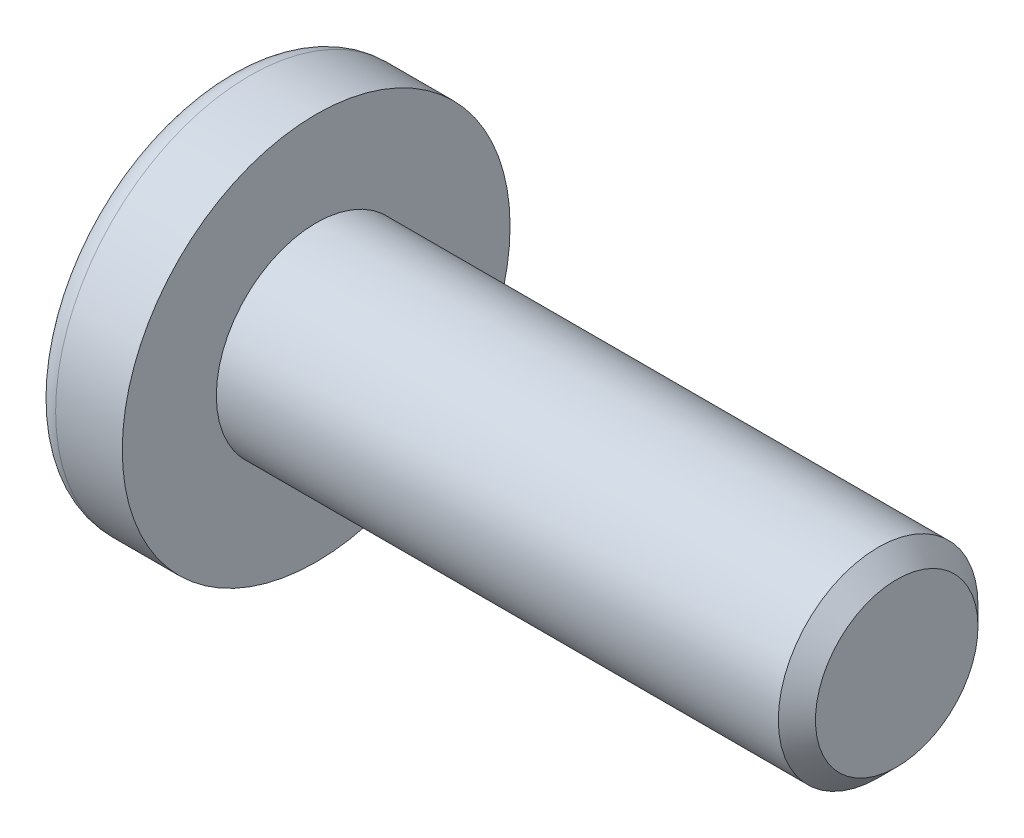
from build123d import *

# Parameters (mm, degrees)
CIRPATTERN1_COUNT = 2
CIRPATTERN1_ANGLE = 90
CHAMFER1_SIZE     = 0.2032


with BuildPart() as part:
    # BodySke → Base-Revolve (revolve)
    with BuildSketch(Plane.XY, mode=Mode.PRIVATE) as base_revolve_sk:
        with BuildLine():
            Line((1.5748, 1.0922), (1.5748, 2.1209))
            Line((1.5748, 2.1209), (0.845695803, 2.1209))
            ThreePointArc((0.845695803, 2.1209), (0.728748015, 2.09237553), (0.638066948, 2.013208777))
            ThreePointArc((0.638066948, 2.013208777), (0.163333253, 1.05595206), (0, 0))
            Line((0, 0), (7.9248, 0))
            Line((7.9248, 0), (7.9248, 1.0922))
            Line((7.9248, 1.0922), (1.5748, 1.0922))
        make_face()
    revolve(base_revolve_sk.sketch.rotate(Axis((-25.4, 0, 0), (1, 0, 0)), 90), axis=Axis((-25.4, 0, 0), (1, 0, 0)))

    # Sketch3 → Cut-Loft1 section 0
    with BuildSketch(Plane(origin=(0, 0, 0), x_dir=(0, 0, -1), z_dir=(1, 0, 0))):
        with BuildLine():
            Line((0.3429, -1.3843), (-0.3429, -1.3843))
            Line((-0.3429, -1.3843), (-0.3429, 1.3843))
            Line((-0.3429, 1.3843), (0.3429, 1.3843))
            Line((0.3429, 1.3843), (0.3429, -1.3843))
        make_face()
    # Sketch4 → Cut-Loft1 section 1
    with BuildSketch(Plane(origin=(1.4986, 0, 0), x_dir=(0, 0, -1), z_dir=(1, 0, 0))):
        with BuildLine():
            Line((0.17145, -0.17145), (-0.17145, -0.17145))
            Line((-0.17145, -0.17145), (-0.17145, 0.17145))
            Line((-0.17145, 0.17145), (0.17145, 0.17145))
            Line((0.17145, 0.17145), (0.17145, -0.17145))
        make_face()
    cut_loft1 = loft(mode=Mode.SUBTRACT)

    # CirPattern1: Cut-Loft1 ×2 about axis
    cirpattern1_axis = Axis((0, 0, 0), (1, 0, 0))
    for i in range(1, CIRPATTERN1_COUNT):
        add(cut_loft1.rotate(cirpattern1_axis, i * CIRPATTERN1_ANGLE / (CIRPATTERN1_COUNT - 1)), mode=Mode.SUBTRACT)

    # Chamfer1
    chamfer1_edges = [part.edges().sort_by_distance(p)[0] for p in [
        (7.9248, 0, -1.0922),
    ]]
    chamfer(chamfer1_edges, length=CHAMFER1_SIZE)


solid = part.part
